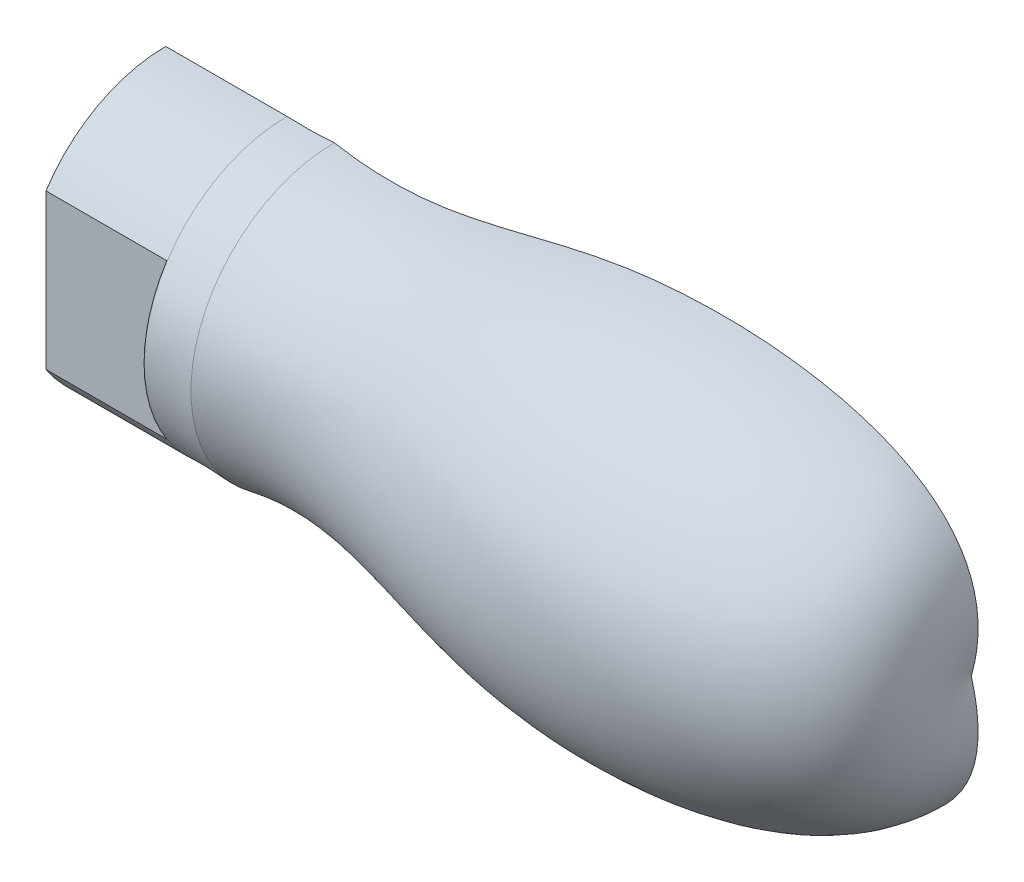
from build123d import *

# Parameters (mm, degrees)
REVOLVE2_ANGLE           = 90
REVOLVE2_OTHER_WAY_ANGLE = 90
SKETCH4_W                = 0.01470915
SKETCH4_H                = 0.03384268
CUT_EXTRUDE1_DEPTH       = 10


with BuildPart() as part:
    # Sketch2 → Revolve2 (revolve)
    with BuildSketch(Plane(origin=(0, 0, 0), x_dir=(1, 0, 0), z_dir=(0, 1, 0))):
        with BuildLine():
            Line((-0.040882846, 0.02), (0.059999999, 0.02))
            Line((0.059999999, 0.02), (0.084987644, 0.02))
            add(Edge.make_bspline(
                [(0.084987644, 0.02), (0.092702041, -0.006864779), (0.032288643, -0.015505972), (0.002470911, 0.000663285), (-0.014544096, -0.002408108)],
                knots=[0, 0, 0, 0, 0.59331664, 1, 1, 1, 1], degree=3))
            add(Edge.make_bspline(
                [(-0.021937137, -0.002277318), (-0.018183593, -0.002107007), (-0.014544096, -0.002408108)],
                knots=[0, 0, 0, 0.074406521, 0.074406521, 0.074406521], degree=2))
            Line((-0.021937137, -0.002277318), (-0.040882846, -0.002277318))
            Line((-0.040882846, -0.002277318), (-0.040882846, 0.02))
        make_face()
    revolve(axis=Axis((-0.040882846, 0, -0.02), (1, 0, 0)), revolution_arc=REVOLVE2_ANGLE)

    # Sketch2 → Revolve2 other way (revolve)
    with BuildSketch(Plane(origin=(0, 0, 0), x_dir=(1, 0, 0), z_dir=(0, 1, 0))):
        with BuildLine():
            Line((-0.040882846, 0.02), (0.059999999, 0.02))
            Line((0.059999999, 0.02), (0.084987644, 0.02))
            add(Edge.make_bspline(
                [(0.084987644, 0.02), (0.092702041, -0.006864779), (0.032288643, -0.015505972), (0.002470911, 0.000663285), (-0.014544096, -0.002408108)],
                knots=[0, 0, 0, 0, 0.59331664, 1, 1, 1, 1], degree=3))
            add(Edge.make_bspline(
                [(-0.021937137, -0.002277318), (-0.018183593, -0.002107007), (-0.014544096, -0.002408108)],
                knots=[0, 0, 0, 0.074406521, 0.074406521, 0.074406521], degree=2))
            Line((-0.021937137, -0.002277318), (-0.040882846, -0.002277318))
            Line((-0.040882846, -0.002277318), (-0.040882846, 0.02))
        make_face()
    revolve(axis=Axis((-0.040882846, 0, -0.02), (-1, 0, 0)), revolution_arc=REVOLVE2_OTHER_WAY_ANGLE)

    # Sketch4 → Cut-Extrude1 (cut)
    with BuildSketch(Plane(origin=(-0.022, 0, 0), x_dir=(0, 0, -1), z_dir=(1, 0, 0))):
        with Locations((-0.006071578, 0)):
            Rectangle(SKETCH4_W, SKETCH4_H)
    extrude(amount=-CUT_EXTRUDE1_DEPTH, mode=Mode.SUBTRACT)


solid = part.part
